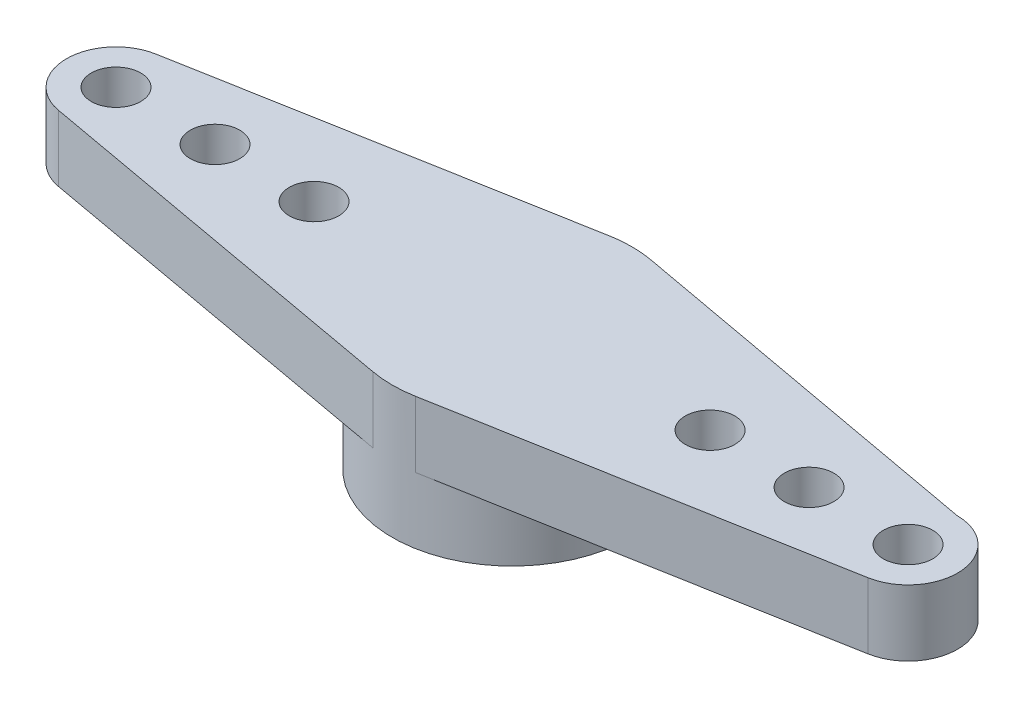
from build123d import *

# Parameters (mm, degrees)
BOSS_EXTRUDE1_DEPTH = 2
SKETCH2_R           = 0.75
CUT_EXTRUDE1_DEPTH  = 15.121858943
BOSS_EXTRUDE2_START = 2
SKETCH4_R           = 3.63
SKETCH4_R_2         = 2.88
BOSS_EXTRUDE2_DEPTH = 2


with BuildPart() as part:
    # Sketch1 → Boss-Extrude1 (new body)
    with BuildSketch(Plane(origin=(0, 0, 0), x_dir=(1, 0, 0), z_dir=(0, 1, 0))):
        with BuildLine():
            Line((-12.26625, 1.476181201), (-0.644325, 3.572358506))
            ThreePointArc((-0.644325, 3.572358506), (0.003746369, 3.629998067), (0.651697383, 3.571020935))
            Line((0.651697383, 3.571020935), (12, 1.5))
            ThreePointArc((12, 1.5), (13.494033434, 0.133656648), (12.26625, -1.476181201))
            Line((12.26625, -1.476181201), (0.644325, -3.572358506))
            ThreePointArc((0.644325, -3.572358506), (0, -3.63), (-0.644325, -3.572358506))
            Line((-0.644325, -3.572358506), (-12.26625, -1.476181201))
            ThreePointArc((-12.26625, -1.476181201), (-13.5, 0), (-12.26625, 1.476181201))
        make_face()
    extrude(amount=BOSS_EXTRUDE1_DEPTH)

    # Sketch2 → Cut-Extrude1 (cut, through all)
    with BuildSketch(Plane(origin=(0, 2, 0), x_dir=(1, 0, 0), z_dir=(0, 1, 0))):
        with Locations(Location((12, 0, 0), (0, 0, 270))):
            Circle(SKETCH2_R)
        with Locations(Location((9, 0, 0), (0, 0, 270))):
            Circle(SKETCH2_R)
        with Locations(Location((6, 0, 0), (0, 0, 270))):
            Circle(SKETCH2_R)
    cut_extrude1 = extrude(amount=-CUT_EXTRUDE1_DEPTH, mode=Mode.SUBTRACT)

    # Mirror1: Cut-Extrude1 across plane
    add(cut_extrude1.mirror(Plane(origin=(0, 0, 0), x_dir=(0, 0, 1), z_dir=(1, 0, 0))), mode=Mode.SUBTRACT)

    # Sketch4 → Boss-Extrude2 (add)
    with BuildSketch(Plane.XZ.offset(BOSS_EXTRUDE2_START)):
        with Locations(Location((0, 0, 0), (0, 0, 270))):
            Circle(SKETCH4_R)
        with Locations(Location((0, 0, 0), (0, 0, 270))):
            Circle(SKETCH4_R_2, mode=Mode.SUBTRACT)
    extrude(amount=-BOSS_EXTRUDE2_DEPTH)


solid = part.part
